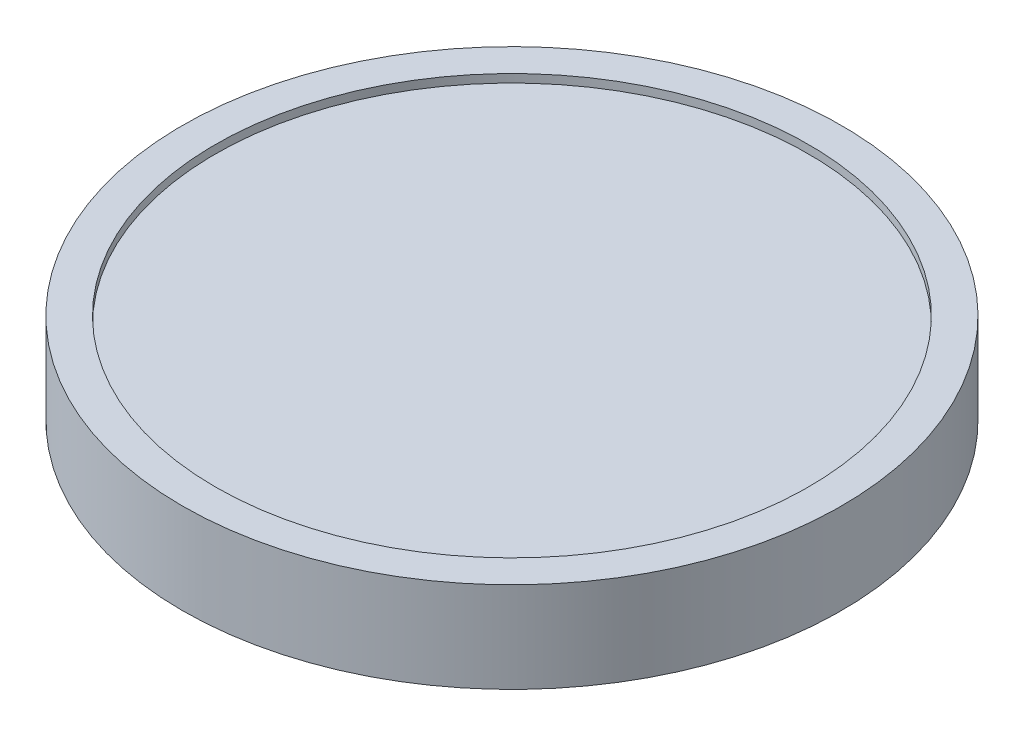
from build123d import *

# Parameters (mm, degrees)
IZIM1_R                     = 40
Y_KSEKLIK_EKSTR_ZYON1_DEPTH = 11
IZIM2_R                     = 36
KES_EKSTR_ZYON2_DEPTH       = 1
IZIM3_W                     = 13
IZIM3_H                     = 16
Y_KSEKLIK_EKSTR_ZYON2_DEPTH = 7


with BuildPart() as part:
    # Çizim1 → Yükseklik-Ekstrüzyon1 (new body)
    with BuildSketch(Plane(origin=(0, 0, 0), x_dir=(1, 0, 0), z_dir=(0, 1, 0))):
        with Locations(Location((-6.982132923, 12.924373709, 0), (0, 0, 270))):
            Circle(IZIM1_R)
    extrude(amount=Y_KSEKLIK_EKSTR_ZYON1_DEPTH)

    # Çizim2 → Kes-Ekstrüzyon2 (cut)
    with BuildSketch(Plane(origin=(0, 11, 0), x_dir=(1, 0, 0), z_dir=(0, 1, 0))):
        with Locations(Location((-6.982132923, 12.924373709, 0), (0, 0, 270))):
            Circle(IZIM2_R)
    extrude(amount=-KES_EKSTR_ZYON2_DEPTH, mode=Mode.SUBTRACT)

    # Çizim3 → Yükseklik-Ekstrüzyon2 (add)
    with BuildSketch(Plane.XZ):
        with Locations((-6.982132923, -12.924373709)):
            Rectangle(IZIM3_W, IZIM3_H)
    extrude(amount=Y_KSEKLIK_EKSTR_ZYON2_DEPTH)


solid = part.part
